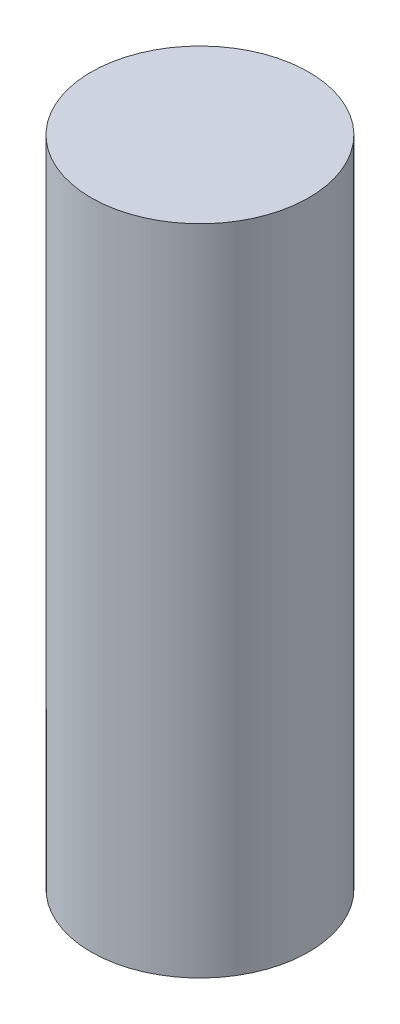
from build123d import *

# Parameters (mm, degrees)
SKETCH1_R           = 6.35
BOSS_EXTRUDE1_DEPTH = 25.4
BOSS_EXTRUDE2_START = -12.7
SKETCH1_4_R         = 6.35
SKETCH1_4_R_2       = 4.7625
BOSS_EXTRUDE2_DEPTH = 12.7


with BuildPart() as part:
    # Sketch1 → Boss-Extrude1 (new body)
    with BuildSketch(Plane(origin=(0, 0, 0), x_dir=(1, 0, 0), z_dir=(0, 1, 0))):
        Circle(SKETCH1_R)
    extrude(amount=BOSS_EXTRUDE1_DEPTH)

    # Sketch1<4> → Boss-Extrude2 (add)
    with BuildSketch(Plane(origin=(0, 0, 0), x_dir=(1, 0, 0), z_dir=(0, 1, 0)).offset(BOSS_EXTRUDE2_START)):
        Circle(SKETCH1_4_R)
        Circle(SKETCH1_4_R_2, mode=Mode.SUBTRACT)
    extrude(amount=BOSS_EXTRUDE2_DEPTH)


solid = part.part
